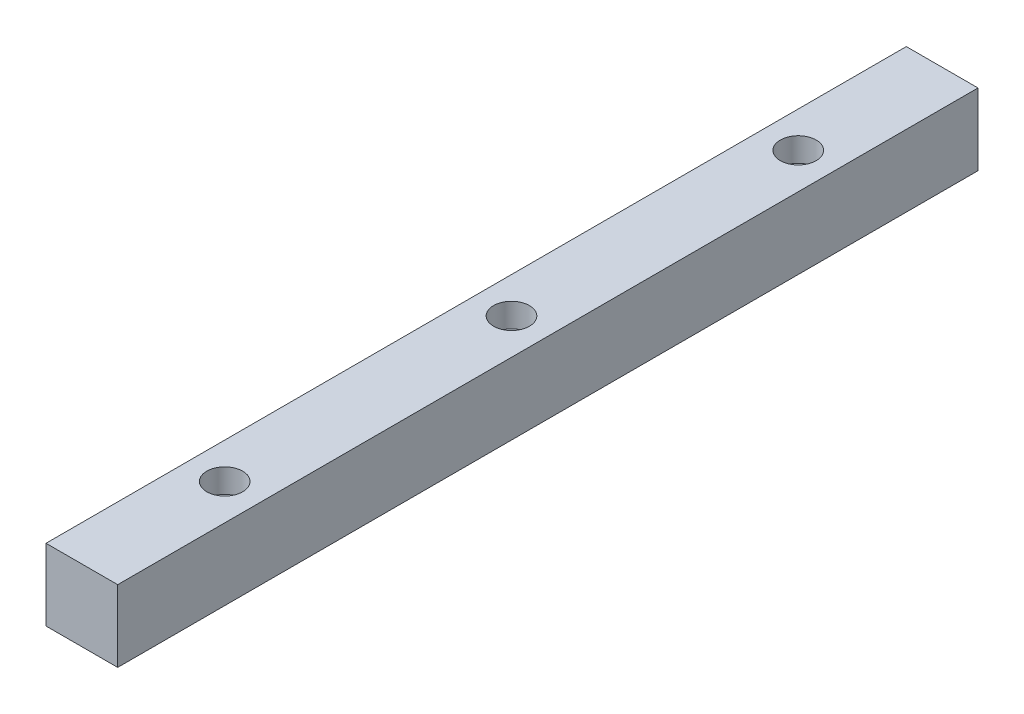
from build123d import *

# Parameters (mm, degrees)
SKETCH_1_W          = 15
SKETCH_1_H          = 180
SKETCH_1_R          = 2
EXTRUDE_1_DEPTH     = 15
SKETCH_2_R          = 3.75
CUT_EXTRUDE_1_DEPTH = 5


with BuildPart() as part:
    # Эскиз1 → Бобышка-Вытянуть1 (new body)
    with BuildSketch(Plane(origin=(0, 0, 0), x_dir=(1, 0, 0), z_dir=(0, 1, 0))):
        with Locations((-55.055059152, 159.322347884)):
            Rectangle(SKETCH_1_W, SKETCH_1_H)
        with Locations(Location((-55.055059152, 219.219125448, 0), (0, 0, 270))):
            Circle(SKETCH_1_R, mode=Mode.SUBTRACT)
        with Locations(Location((-55.055059152, 159.219125448, 0), (0, 0, 270))):
            Circle(SKETCH_1_R, mode=Mode.SUBTRACT)
        with Locations(Location((-55.055059152, 99.219125448, 0), (0, 0, 270))):
            Circle(SKETCH_1_R, mode=Mode.SUBTRACT)
    extrude(amount=EXTRUDE_1_DEPTH)

    # Эскиз2 → Вырез-Вытянуть1 (cut)
    with BuildSketch(Plane(origin=(0, 15, 0), x_dir=(1, 0, 0), z_dir=(0, 1, 0))):
        with Locations(Location((-55.055059152, 99.219125448, 0), (0, 0, 270))):
            Circle(SKETCH_2_R)
        with Locations(Location((-55.055059152, 159.219125448, 0), (0, 0, 270))):
            Circle(SKETCH_2_R)
        with Locations(Location((-55.055059152, 219.219125448, 0), (0, 0, 270))):
            Circle(SKETCH_2_R)
    extrude(amount=-CUT_EXTRUDE_1_DEPTH, mode=Mode.SUBTRACT)


solid = part.part
